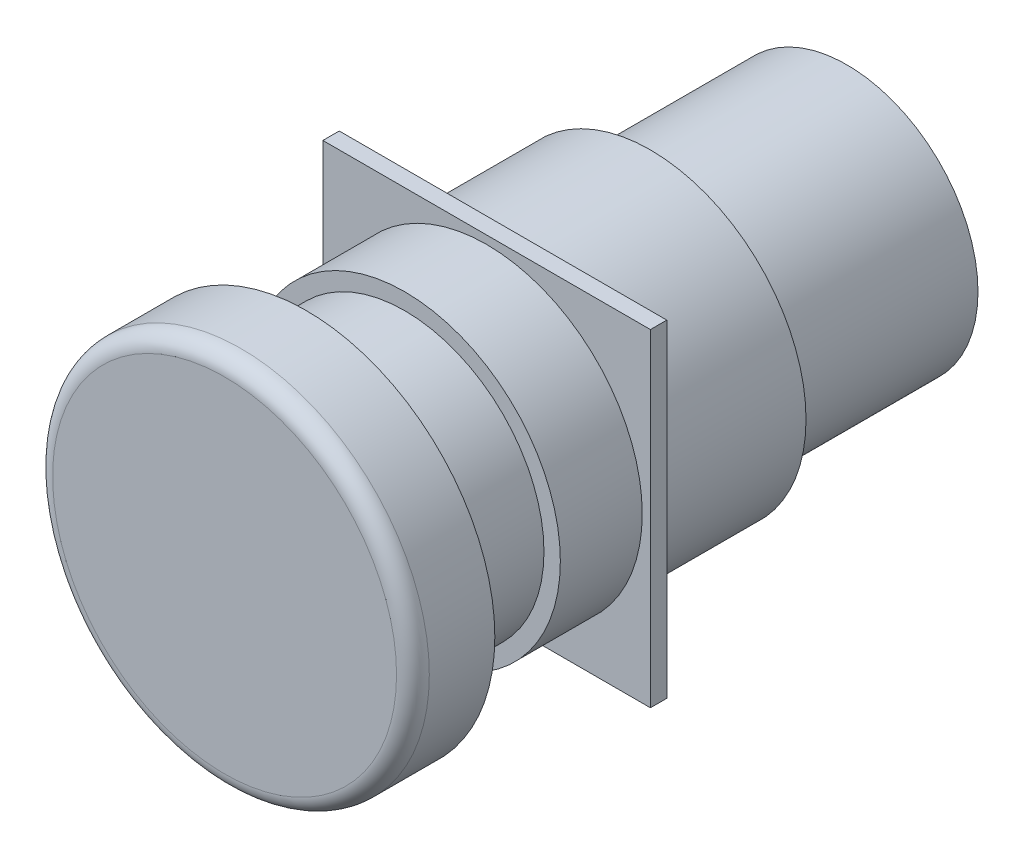
from build123d import *

# Parameters (mm, degrees)
SKETCH_1_W          = 11.5
SKETCH_1_H          = 5
SKETCH_2_R          = 10.5
CUT_EXTRUDE_1_DEPTH = 4
SKETCH_3_R          = 8.5
EXTRUDE_1_DEPTH     = 10
SKETCH_4_R          = 9.5
EXTRUDE_2_DEPTH     = 5
SKETCH_5_W          = 20
SKETCH_5_H          = 20
EXTRUDE_3_DEPTH     = 1
SKETCH_6_R          = 9.5
EXTRUDE_4_DEPTH     = 9
SKETCH_7_R          = 8
EXTRUDE_5_DEPTH     = 12
FILLET_1_R          = 1


with BuildPart() as part:
    # 草图1 → 旋转1 (revolve)
    with BuildSketch(Plane(origin=(0, 0, 0), x_dir=(1, 0, 0), z_dir=(0, 1, 0))):
        with Locations((5.75, -2.5)):
            Rectangle(SKETCH_1_W, SKETCH_1_H)
    revolve(axis=Axis((0, 0, 0), (0, 0, 1)))

    # 草图2 → 切除-拉伸1 (cut)
    with BuildSketch(Plane(origin=(0, 0, 0), x_dir=(-1, 0, 0), z_dir=(0, 0, -1))):
        with Locations(Location((0, 0, 0), (0, 0, 180))):
            Circle(SKETCH_2_R)
    extrude(amount=-CUT_EXTRUDE_1_DEPTH, mode=Mode.SUBTRACT)

    # 草图3 → 凸台-拉伸1 (add)
    with BuildSketch(Plane(origin=(0, 0, 4), x_dir=(-1, 0, 0), z_dir=(0, 0, -1))):
        with Locations(Location((0, 0, 0), (0, 0, 180))):
            Circle(SKETCH_3_R)
    extrude(amount=EXTRUDE_1_DEPTH)

    # 草图4 → 凸台-拉伸2 (add)
    with BuildSketch(Plane.XY.offset(-6)):
        with Locations(Location((0, 0, 0), (0, 0, 180))):
            Circle(SKETCH_4_R)
    extrude(amount=-EXTRUDE_2_DEPTH)

    # 草图5 → 凸台-拉伸3 (add)
    with BuildSketch(Plane.XY.offset(-11)):
        Rectangle(SKETCH_5_W, SKETCH_5_H)
    extrude(amount=-EXTRUDE_3_DEPTH)

    # 草图6 → 凸台-拉伸4 (add)
    with BuildSketch(Plane(origin=(0, 0, -12), x_dir=(-1, 0, 0), z_dir=(0, 0, -1))):
        Circle(SKETCH_6_R)
    extrude(amount=EXTRUDE_4_DEPTH)

    # 草图7 → 凸台-拉伸5 (add)
    with BuildSketch(Plane(origin=(0, 0, -21), x_dir=(-1, 0, 0), z_dir=(0, 0, -1))):
        Circle(SKETCH_7_R)
    extrude(amount=EXTRUDE_5_DEPTH)

    # 圆角1
    fillet_1_edges = [part.edges().sort_by_distance(p)[0] for p in [
        (-11.5, 0, 5),
    ]]
    fillet(fillet_1_edges, radius=FILLET_1_R)


solid = part.part
